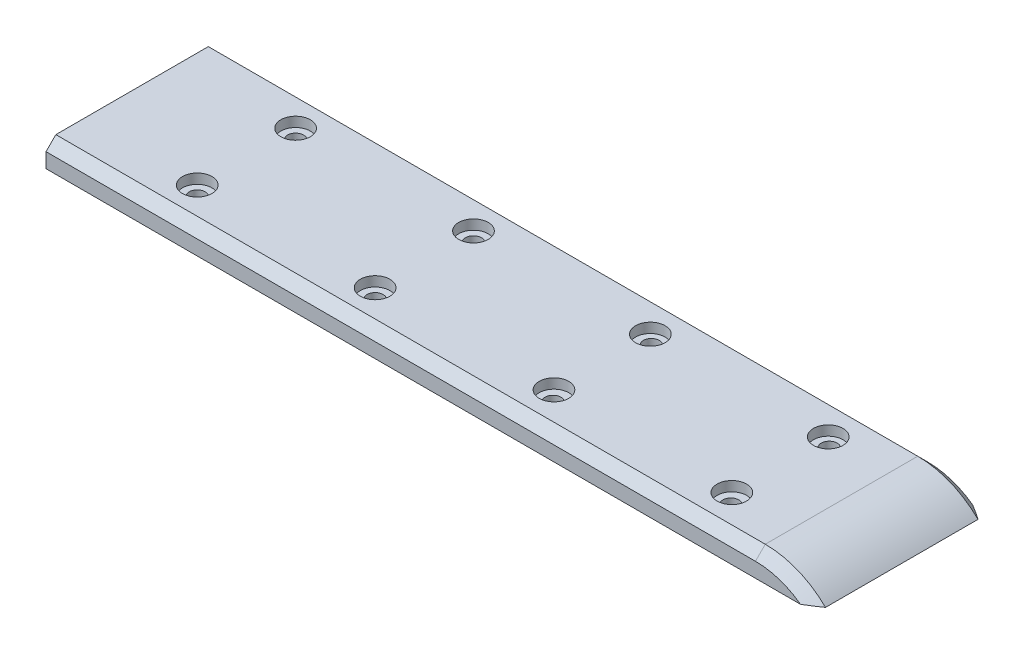
from build123d import *

# Parameters (mm, degrees)
BOSS_EXTRUDE1_DEPTH = 17.5
SKETCH2_W           = 18
SKETCH2_H           = 5
CUT_EXTRUDE1_DEPTH  = 17.5
SKETCH3_R           = 1.625
CUT_EXTRUDE2_DEPTH  = 5
SKETCH4_R           = 3
CUT_EXTRUDE3_DEPTH  = 2
CHAMFER1_SIZE       = 2


with BuildPart() as part:
    # Sketch1 → Boss-Extrude1 (new, symmetric)
    with BuildSketch(Plane.XY):
        with BuildLine():
            Line((-75, 17.5), (75, 17.5))
            ThreePointArc((75, 17.5), (81.614378278, 16.201851746), (87.247448714, 12.5))
            Line((87.247448714, 12.5), (-87.247448714, 12.5))
            ThreePointArc((-87.247448714, 12.5), (-81.614378278, 16.201851746), (-75, 17.5))
        make_face()
    extrude(amount=BOSS_EXTRUDE1_DEPTH, both=True)

    # Sketch2 → Cut-Extrude1 (cut, symmetric)
    with BuildSketch(Plane.XY):
        with Locations((-78.247448714, 15)):
            Rectangle(SKETCH2_W, SKETCH2_H)
    extrude(amount=CUT_EXTRUDE1_DEPTH, both=True, mode=Mode.SUBTRACT)

    # Sketch3 → Cut-Extrude2 (cut)
    with BuildSketch(Plane.XZ.offset(-12.5)):
        with Locations((-46, -10)):
            Circle(SKETCH3_R)
        with Locations((-9.833333333, -10)):
            Circle(SKETCH3_R)
        with Locations((26.333333333, -10)):
            Circle(SKETCH3_R)
        with Locations((62.5, -10)):
            Circle(SKETCH3_R)
    cut_extrude2 = extrude(amount=-CUT_EXTRUDE2_DEPTH, mode=Mode.SUBTRACT)

    # Sketch4 → Cut-Extrude3 (cut)
    with BuildSketch(Plane(origin=(0, 17.5, 0), x_dir=(1, 0, 0), z_dir=(0, 1, 0))):
        with Locations(Location((62.5, 9.8, 0), (0, 0, 180))):
            Circle(SKETCH4_R)
        with Locations(Location((26.333333333, 9.8, 0), (0, 0, 180))):
            Circle(SKETCH4_R)
        with Locations(Location((-9.833333333, 10, 0), (0, 0, 180))):
            Circle(SKETCH4_R)
        with Locations(Location((-46, 10, 0), (0, 0, 180))):
            Circle(SKETCH4_R)
    cut_extrude3 = extrude(amount=-CUT_EXTRUDE3_DEPTH, mode=Mode.SUBTRACT)

    # Mirror1: Cut-Extrude2, Cut-Extrude3 across plane
    add(cut_extrude2.mirror(Plane.XY), mode=Mode.SUBTRACT)
    add(cut_extrude3.mirror(Plane.XY), mode=Mode.SUBTRACT)

    # Chamfer1
    chamfer1_edges = [part.edges().sort_by_distance(p)[0] for p in [
        (81.614378278, 16.201851746, 17.5),
        (2.876275643, 17.5, 17.5),
        (2.876275643, 17.5, -17.5),
        (81.614378278, 16.201851746, -17.5),
    ]]
    chamfer(chamfer1_edges, length=CHAMFER1_SIZE)


solid = part.part
